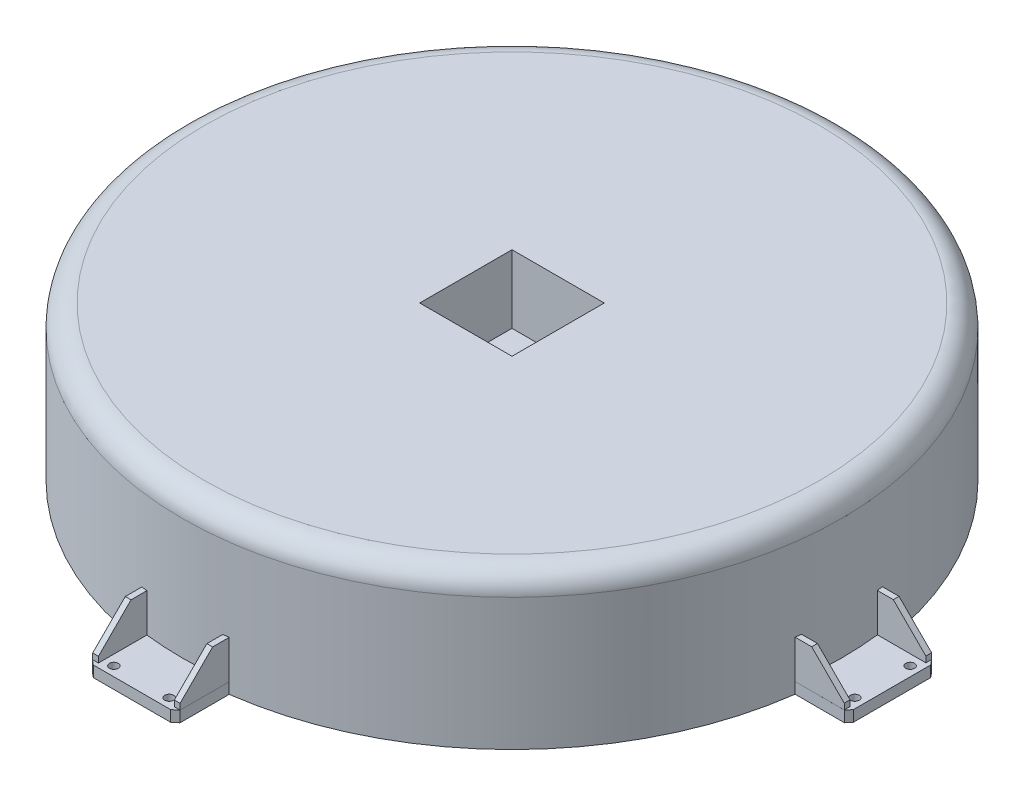
from build123d import *

# Parameters (mm, degrees)
IZIM1_R                      = 150
Y_KSEKLIK_EKSTR_ZYON1_DEPTH  = 70
Y_KSEKLIK_EKSTR_ZYON14_DEPTH = 5
Y_KSEKLIK_EKSTR_ZYON16_DEPTH = 17.5
KES_EKSTR_ZYON1_DEPTH        = 27.5
KES_EKSTR_ZYON3_DEPTH        = 7.5
Y_KSEKLIK_EKSTR_ZYON17_DEPTH = 6
DAIRESEL_KAPLAMA1_COUNT      = 4
DAIRESEL_KAPLAMA2_COUNT      = 4
RADYUS1_R                    = 10
IZIM19_R                     = 2
KES_EKSTR_ZYON5_DEPTH        = 10
IZIM22_R                     = 140
Y_KSEKLIK_EKSTR_ZYON18_DEPTH = 1
KES_EKSTR_ZYON8_DEPTH        = 11
KES_EKSTR_ZYON8_DEPTH_BACK   = 31
IZIM18_W                     = 42
IZIM18_H                     = 42


with BuildPart() as part:
    # Çizim1 → Yükseklik-Ekstrüzyon1 (new body)
    with BuildSketch(Plane(origin=(0, 0, 0), x_dir=(1, 0, 0), z_dir=(0, 1, 0))):
        with Locations(Location((0, 0, 0), (0, 0, 270))):
            Circle(IZIM1_R)
    extrude(amount=Y_KSEKLIK_EKSTR_ZYON1_DEPTH)

    # Çizim2 → Yükseklik-Ekstrüzyon14 (add)
    with BuildSketch(Plane(origin=(0, 0, 0), x_dir=(1, 0, 0), z_dir=(0, 1, 0))):
        with BuildLine():
            Line((-19.938381567, 146.7204745), (-19.959218349, 172.993465408))
            Line((-19.959218349, 172.993465408), (19.834593255, 172.993465408))
            Line((19.834593255, 172.993465408), (19.793688749, 146.733102083))
            add(Edge.make_bspline(
                [(-19.938381567, 146.7204745), (-6.821574105, 149.387431492), (6.677589472, 149.400040821), (19.793688749, 146.733102083)],
                knots=[0, 0, 0, 0, 0.935808431, 0.935808431, 0.935808431, 0.935808431], degree=3))
        make_face()
    y_kseklik_ekstr_zyon14 = extrude(amount=Y_KSEKLIK_EKSTR_ZYON14_DEPTH)

    # Çizim11 → Yükseklik-Ekstrüzyon16 (add)
    with BuildSketch(Plane(origin=(0, 5, 0), x_dir=(1, 0, 0), z_dir=(0, 1, 0))):
        Polygon((-19.957686049, 171.061396107), (-17.341172439, 171.061396107), (-17.341172439, 146.643122555), (-19.949304151, 146.643122555), align=None)
        Polygon((17.194554667, 146.643122555), (19.802686379, 146.643122555), (19.811068277, 171.061396107), (17.194554667, 171.061396107), align=None)
    y_kseklik_ekstr_zyon16 = extrude(amount=Y_KSEKLIK_EKSTR_ZYON16_DEPTH)

    # Çizim12 → Kes-Ekstrüzyon1 (cut, symmetric)
    with BuildSketch(Plane(origin=(0, 0, 0), x_dir=(0, 0, -1), z_dir=(1, 0, 0))):
        Polygon((155.535554898, 23.200577764), (171.374705499, 7.361427163), (171.374705499, 23.200577764), align=None)
    kes_ekstr_zyon1 = extrude(amount=KES_EKSTR_ZYON1_DEPTH, both=True, mode=Mode.SUBTRACT)

    # Çizim13 → Kes-Ekstrüzyon3 (cut)
    with BuildSketch(Plane(origin=(0, 0, 0), x_dir=(1, 0, 0), z_dir=(0, 1, 0))):
        Polygon((-19.957686049, 171.061396107), (-17.341172439, 173.196821818), (-20.112409128, 173.196821818), (-20.112409128, 171.061396107), align=None)
        Polygon((20.112409128, 173.196821818), (20.112409128, 171.061396107), (19.957686049, 171.061396107), (17.341172439, 173.196821818), align=None)
    kes_ekstr_zyon3 = extrude(amount=KES_EKSTR_ZYON3_DEPTH, mode=Mode.SUBTRACT)

    # Çizim17 → Yükseklik-Ekstrüzyon17 (add)
    with BuildSketch(Plane(origin=(0, 0, 0), x_dir=(1, 0, 0), z_dir=(0, 1, 0))):
        Polygon((11.703099503, 121.823652722), (9.703099523, 121.82337545), (8.703339657, 120.091186024), (9.703579771, 118.359273869), (11.703579752, 118.35955114), (12.703339618, 120.091740567), align=None)
        Polygon((-9.703579771, 118.359273869), (-11.703579752, 118.35955114), (-12.703339618, 120.091740567), (-11.703099503, 121.823652722), (-9.703099523, 121.82337545), (-8.703339657, 120.091186024), align=None)
    y_kseklik_ekstr_zyon17 = extrude(amount=Y_KSEKLIK_EKSTR_ZYON17_DEPTH)

    # Dairesel Kaplama1: Yükseklik-Ekstrüzyon14, Yükseklik-Ekstrüzyon16, Kes-Ekstrüzyon3, Yükseklik-Ekstrüzyon17 ×4 about axis
    dairesel_kaplama1_axis = Axis((0, 0, 0), (0, 1, 0))
    add([y_kseklik_ekstr_zyon14.rotate(dairesel_kaplama1_axis, i * 360 / DAIRESEL_KAPLAMA1_COUNT) for i in range(1, DAIRESEL_KAPLAMA1_COUNT)])
    add([y_kseklik_ekstr_zyon16.rotate(dairesel_kaplama1_axis, i * 360 / DAIRESEL_KAPLAMA1_COUNT) for i in range(1, DAIRESEL_KAPLAMA1_COUNT)])
    add([kes_ekstr_zyon3.rotate(dairesel_kaplama1_axis, i * 360 / DAIRESEL_KAPLAMA1_COUNT) for i in range(1, DAIRESEL_KAPLAMA1_COUNT)], mode=Mode.SUBTRACT)
    add([y_kseklik_ekstr_zyon17.rotate(dairesel_kaplama1_axis, i * 360 / DAIRESEL_KAPLAMA1_COUNT) for i in range(1, DAIRESEL_KAPLAMA1_COUNT)])

    # Dairesel Kaplama2: Kes-Ekstrüzyon1 ×4 about axis
    dairesel_kaplama2_axis = Axis((0, 0, 0), (0, 1, 0))
    for i in range(1, DAIRESEL_KAPLAMA2_COUNT):
        add(kes_ekstr_zyon1.rotate(dairesel_kaplama2_axis, i * 360 / DAIRESEL_KAPLAMA2_COUNT), mode=Mode.SUBTRACT)

    # Radyus1
    radyus1_edges = [part.edges().sort_by_distance(p)[0] for p in [
        (0, 70, -150),
    ]]
    fillet(radyus1_edges, radius=RADYUS1_R)

    # Çizim19 → Kes-Ekstrüzyon5 (cut)
    with BuildSketch(Plane(origin=(0, 5, 0), x_dir=(1, 0, 0), z_dir=(0, 1, 0))):
        with Locations(Location((-12.590175798, 168.65903489, 0), (0, 0, 270))):
            Circle(IZIM19_R)
        with Locations(Location((12.590175798, 168.65903489, 0), (0, 0, 270))):
            Circle(IZIM19_R)
        with Locations(Location((168.65903489, 12.590175798, 0), (0, 0, 270))):
            Circle(IZIM19_R)
        with Locations(Location((168.65903489, -12.590175798, 0), (0, 0, 270))):
            Circle(IZIM19_R)
        with Locations(Location((12.590175798, -168.65903489, 0), (0, 0, 270))):
            Circle(IZIM19_R)
        with Locations(Location((-12.590175798, -168.65903489, 0), (0, 0, 270))):
            Circle(IZIM19_R)
        with Locations(Location((-168.65903489, -12.590175798, 0), (0, 0, 270))):
            Circle(IZIM19_R)
        with Locations(Location((-168.65903489, 12.590175798, 0), (0, 0, 270))):
            Circle(IZIM19_R)
    extrude(amount=-KES_EKSTR_ZYON5_DEPTH, mode=Mode.SUBTRACT)

    # Çizim22 → Yükseklik-Ekstrüzyon18 (add)
    with BuildSketch(Plane(origin=(0, 70, 0), x_dir=(1, 0, 0), z_dir=(0, 1, 0))):
        Circle(IZIM22_R)
    extrude(amount=-Y_KSEKLIK_EKSTR_ZYON18_DEPTH)

    # Çizim18 → Kes-Ekstrüzyon8 (cut, two sides: drawn at the far end of the back side and taken through both)
    with BuildSketch(Plane(origin=(0, 70, 0), x_dir=(1, 0, 0), z_dir=(0, 1, 0)).offset(-KES_EKSTR_ZYON8_DEPTH_BACK)):
        Rectangle(IZIM18_W, IZIM18_H)
    extrude(amount=KES_EKSTR_ZYON8_DEPTH + KES_EKSTR_ZYON8_DEPTH_BACK, mode=Mode.SUBTRACT)


solid = part.part
